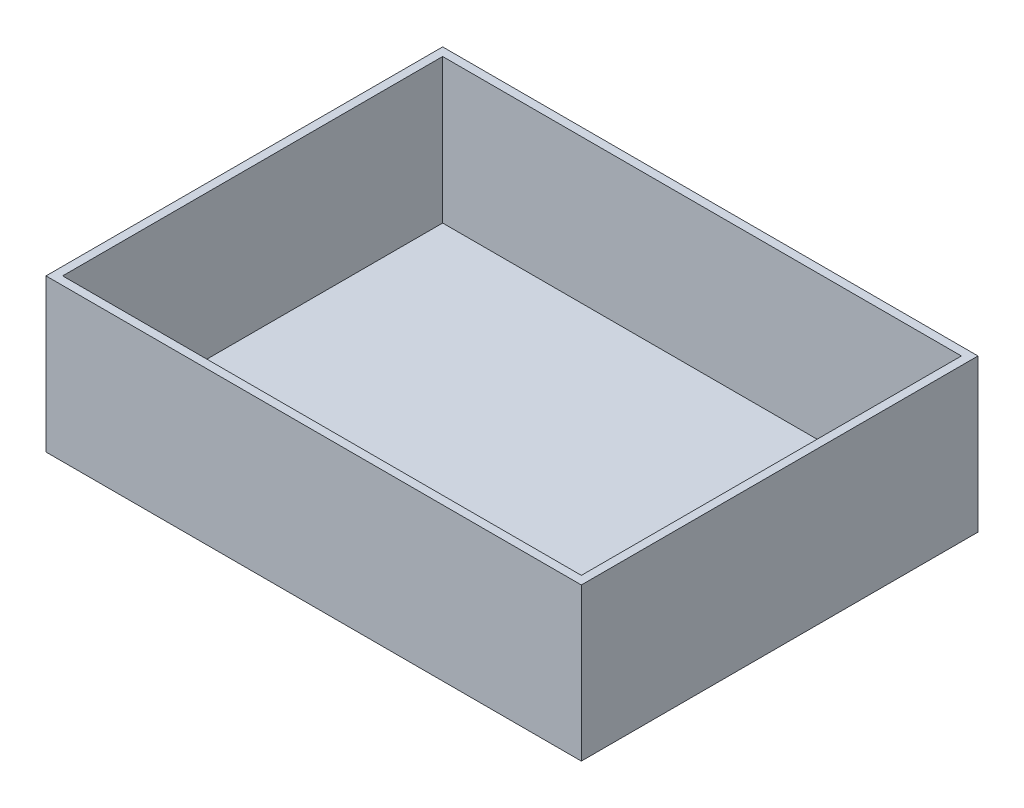
from build123d import *

# Parameters (mm, degrees)
SKETCH1_W           = 193
SKETCH1_H           = 143
BOSS_EXTRUDE1_DEPTH = 55
SHELL1_T            = -3


with BuildPart() as part:
    # Sketch1 → Boss-Extrude1 (new body)
    with BuildSketch(Plane(origin=(0, 0, 0), x_dir=(1, 0, 0), z_dir=(0, 1, 0))):
        Rectangle(SKETCH1_W, SKETCH1_H)
    extrude(amount=BOSS_EXTRUDE1_DEPTH)

    # Shell1
    shell1_openings = [part.faces().sort_by_distance(p)[0] for p in [
        (0, 55, 0),
    ]]
    offset(amount=SHELL1_T, openings=shell1_openings, kind=Kind.INTERSECTION)


solid = part.part
